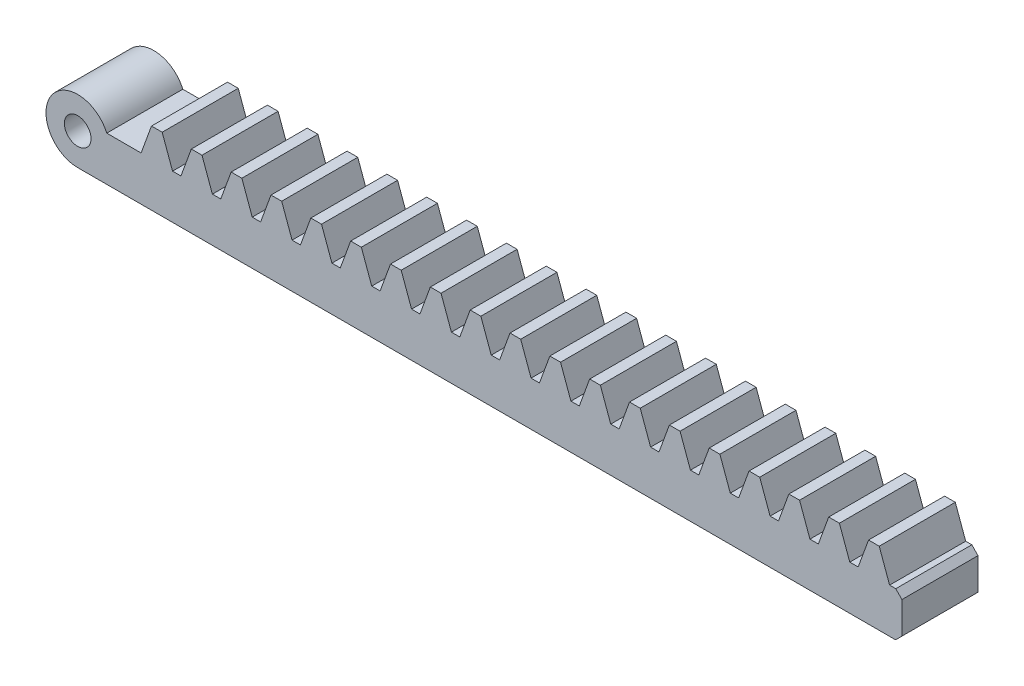
from build123d import *

# Parameters (mm, degrees)
SKETCH_1_W             = 60
SKETCH_1_H             = 3.5
EXTRUDE_1_DEPTH        = 6
EXTRUDE_2_DEPTH        = 6
PATTERN_LINEAR_1_COUNT = 19
PATTERN_LINEAR_1_PITCH = 3.141592654
SKETCH_3_R             = 1.05
EXTRUDE_1_2_DEPTH      = 6
CUT_EXTRUDE_2_DEPTH    = 6


with BuildPart() as part:
    # 草图1 → Extrude 1 (new body)
    with BuildSketch(Plane.XY):
        with Locations((30, -1.75)):
            Rectangle(SKETCH_1_W, SKETCH_1_H)
    extrude(amount=EXTRUDE_1_DEPTH)

    # 草图2 → 拉伸2 (add)
    with BuildSketch(Plane.XY.offset(6)):
        Polygon((0, 0), (0.818933027, 2.25), (1.661788885, 2.25), (2.480721912, 0), align=None)
    extrude_2 = extrude(amount=-EXTRUDE_2_DEPTH)

    # 阵列(线性)1: 拉伸2 ×19
    with Locations(*[(i * PATTERN_LINEAR_1_PITCH, 0, 0) for i in range(1, PATTERN_LINEAR_1_COUNT)]):
        add(extrude_2)

    # 草图3 → Extrude 1 2 (add)
    with BuildSketch(Plane(origin=(0, 0, 0), x_dir=(-1, 0, 0), z_dir=(0, 0, -1))):
        with BuildLine():
            Line((5, -3.5), (0, -3.5))
            Line((0, -3.5), (0, 0))
            Line((0, 0), (2.708711936, 0))
            ThreePointArc((2.708711936, 0), (7.091650043, 0.36930643), (5, -3.5))
        make_face()
        with Locations((5, -1)):
            Circle(SKETCH_3_R, mode=Mode.SUBTRACT)
    extrude(amount=-EXTRUDE_1_2_DEPTH)

    # 草图5 → 切除-拉伸2 (cut)
    with BuildSketch(Plane(origin=(0, 0, 0), x_dir=(-1, 0, 0), z_dir=(0, 0, -1))):
        Polygon((-59.514694839, 0), (-60, -0.5), (-60, 0), align=None)
        Polygon((-60, -3.5), (-60, -3), (-59.5, -3.5), align=None)
    extrude(amount=-CUT_EXTRUDE_2_DEPTH, mode=Mode.SUBTRACT)


solid = part.part
